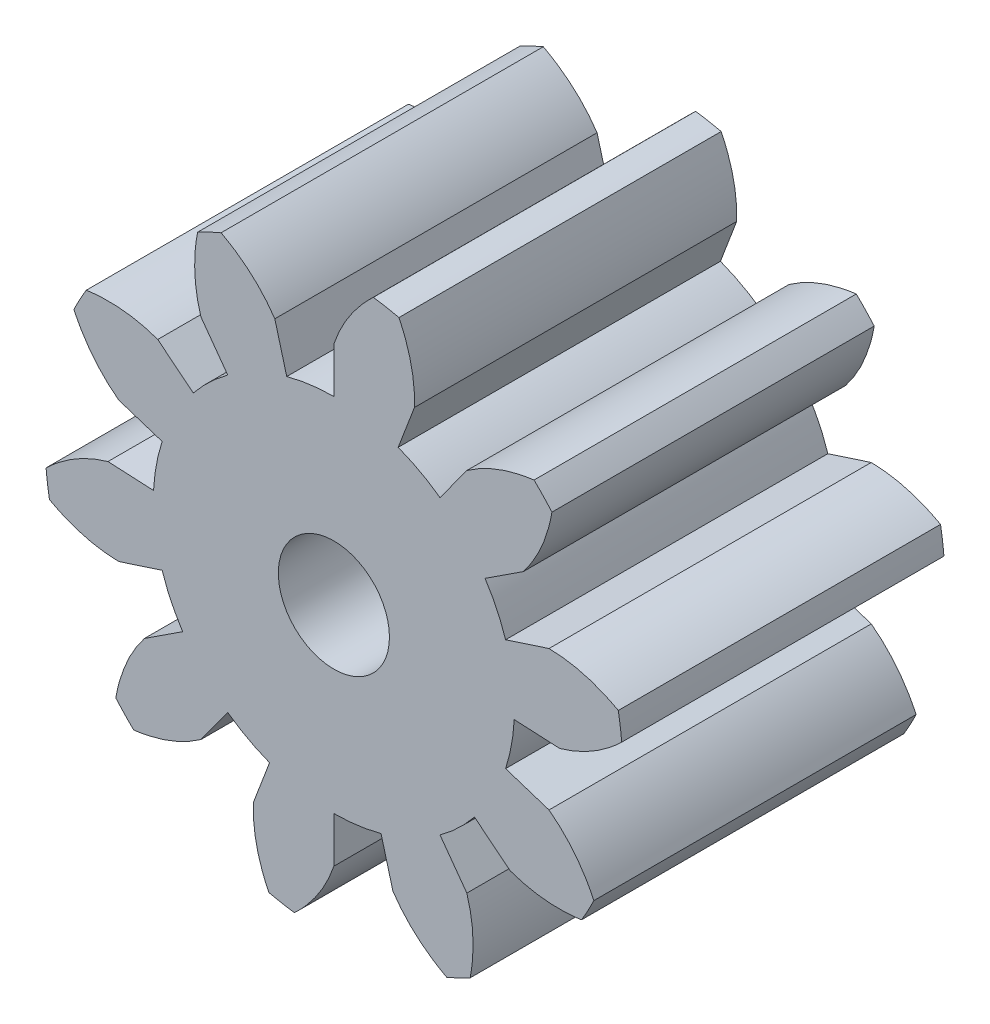
from build123d import *

# Parameters (mm, degrees)
BOSS_EXTRUDE1_DEPTH = 43.5
CIRPATTERN1_COUNT   = 10
SKETCH2_R           = 7.5
CUT_EXTRUDE1_DEPTH  = 70.959609915


with BuildPart() as part:
    # Sketch1 → Boss-Extrude1 (new body)
    with BuildSketch(Plane.XY):
        with BuildLine():
            add(Edge.make_bspline(
                [(0, 30.535), (1.094025697, 33.738879921), (2.960368297, 36.423385517), (5.329249796, 38.634170065)],
                knots=[0, 0, 0, 0, 0.089409401, 0.089409401, 0.089409401, 0.089409401], degree=3))
            Line((0, 30.535), (0, 24.375))
            ThreePointArc((0, 24.375), (-4.413773565, -23.972050974), (8.681616812, 22.776526393))
            Line((8.681616812, 22.776526393), (10.875617204, 28.532563422))
            add(Edge.make_bspline(
                [(10.875617204, 28.532563422), (10.994458338, 31.915995933), (10.206644899, 35.089189117), (8.780523558, 37.998715847)],
                knots=[0, 0, 0, 0, 0.089409401, 0.089409401, 0.089409401, 0.089409401], degree=3))
            ThreePointArc((8.780523558, 37.998715847), (7.062037704, 38.355281559), (5.329249796, 38.634170065))
        make_face()
    boss_extrude1 = extrude(amount=BOSS_EXTRUDE1_DEPTH)

    # CirPattern1: Boss-Extrude1 ×10 about axis
    cirpattern1_axis = Axis((0, 0, 43.5), (0, 0, 1))
    for i in range(1, CIRPATTERN1_COUNT):
        add(boss_extrude1.rotate(cirpattern1_axis, i * 360 / CIRPATTERN1_COUNT))

    # Sketch2 → Cut-Extrude1 (cut, through all)
    with BuildSketch(Plane.XY.offset(43.5)):
        Circle(SKETCH2_R)
    extrude(amount=-CUT_EXTRUDE1_DEPTH, mode=Mode.SUBTRACT)


solid = part.part
